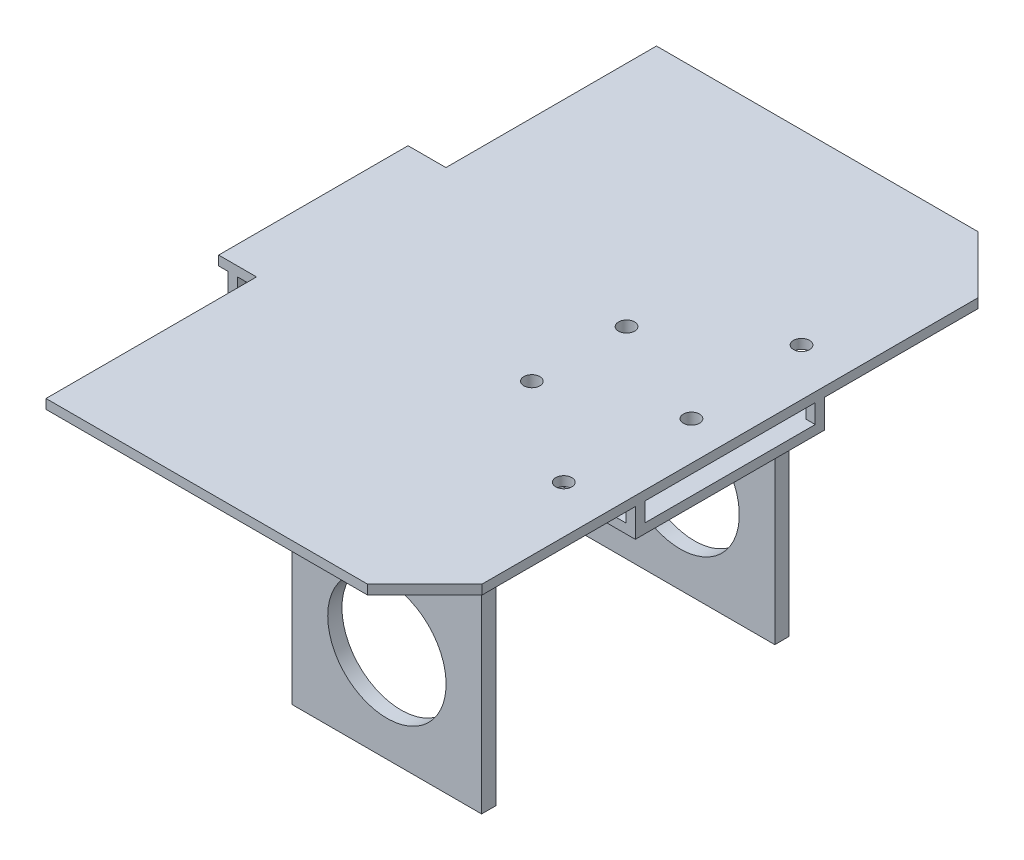
from build123d import *

# Parameters (mm, degrees)
SKETCH1_W                = 40
SKETCH1_H                = 40
BOSS_EXTRUDE1_DEPTH      = 2
SKETCH10_W               = 40
SKETCH10_H               = 2
BOSS_EXTRUDE4_DEPTH      = 4
SKETCH11_W               = 40
SKETCH11_H               = 40
BOSS_EXTRUDE5_DEPTH      = 2
M3_CLEARANCE_HOLE1_D     = 3.4
SKETCH5_W                = 40
SKETCH5_H                = 2
BOSS_EXTRUDE2_DEPTH      = 48
SKETCH6_W                = 2
SKETCH6_H                = 40
BOSS_EXTRUDE3_DEPTH      = 6
SKETCH7_W                = 2
SKETCH7_H                = 28
CUT_EXTRUDE1_DEPTH       = 6
M3_CLEARANCE_HOLE2_D     = 3.4
M3_CLEARANCE_HOLE2_DEPTH = 2
M3_CLEARANCE_HOLE2_TIP   = 1.021463052
SKETCH12_W               = 36
SKETCH12_H               = 4
CUT_EXTRUDE2_DEPTH       = 63.992062992
EXTRUDE_THIN1_REACH      = 64.769
SKETCH13_R               = 3.7
SKETCH13_R_2             = 1.7
SKETCH14_W               = 40
SKETCH14_H               = 2
BOSS_EXTRUDE6_DEPTH      = 44.465
M3_CLEARANCE_HOLE3_D     = 3.4
SKETCH19_W               = 40
SKETCH19_H               = 2
BOSS_EXTRUDE7_DEPTH      = 44.465
SKETCH20_R               = 1.7
CUT_EXTRUDE3_DEPTH       = 98.479927293
CUT_EXTRUDE4_DEPTH       = 98.479927293
SKETCH24_W               = 44.465
SKETCH24_H               = 2
BOSS_EXTRUDE9_DEPTH      = 40
SKETCH22_W               = 40
SKETCH22_H               = 3
BOSS_EXTRUDE8_DEPTH      = 60
FILLET1_R                = 2
CUT_EXTRUDE5_REACH       = 122.894
SKETCH23_R               = 12.5
FILLET1_OF_MIRROR1_R     = 2


with BuildPart() as part:
    # Sketch1 → Boss-Extrude1 (new body)
    with BuildSketch(Plane(origin=(0, 0, 0), x_dir=(1, 0, 0), z_dir=(0, 1, 0))):
        with Locations((20, 20)):
            Rectangle(SKETCH1_W, SKETCH1_H)
    extrude(amount=BOSS_EXTRUDE1_DEPTH)

    # Sketch10 → Boss-Extrude4 (add)
    with BuildSketch(Plane(origin=(0, 2, 0), x_dir=(1, 0, 0), z_dir=(0, 1, 0))):
        with Locations((20, 1)):
            Rectangle(SKETCH10_W, SKETCH10_H)
        with Locations((20, 39)):
            Rectangle(SKETCH10_W, SKETCH10_H)
    extrude(amount=BOSS_EXTRUDE4_DEPTH)

    # Sketch11 → Boss-Extrude5 (add)
    with BuildSketch(Plane(origin=(0, 6, 0), x_dir=(1, 0, 0), z_dir=(0, 1, 0))):
        with Locations((20, 20)):
            Rectangle(SKETCH11_W, SKETCH11_H)
    extrude(amount=BOSS_EXTRUDE5_DEPTH)

    # M3 Clearance Hole1 (through all)
    with Locations(Plane.XZ):
        with Locations((8.15, -30), (8.15, -10), (31.85, -20)):
            Hole(M3_CLEARANCE_HOLE1_D / 2)

    # Sketch5 → Boss-Extrude2 (add)
    with BuildSketch(Plane(origin=(0, 0, 0), x_dir=(0, 0, -1), z_dir=(1, 0, 0))):
        with Locations((20, 7)):
            Rectangle(SKETCH5_W, SKETCH5_H)
    extrude(amount=-BOSS_EXTRUDE2_DEPTH)

    # Sketch6 → Boss-Extrude3 (add)
    with BuildSketch(Plane(origin=(-6, 6, 0), x_dir=(-1, 0, 0), z_dir=(0, 1, 0))):
        with Locations((39, -20)):
            Rectangle(SKETCH6_W, SKETCH6_H)
    extrude(amount=-BOSS_EXTRUDE3_DEPTH)

    # Sketch7 → Cut-Extrude1 (cut)
    with BuildSketch(Plane(origin=(46, 0, 0), x_dir=(-1, 0, 0), z_dir=(0, 1, 0))):
        with Locations((91, -20)):
            Rectangle(SKETCH7_W, SKETCH7_H)
    extrude(amount=CUT_EXTRUDE1_DEPTH, mode=Mode.SUBTRACT)

    # M3 Clearance Hole2
    with Locations(Plane(origin=(-46, 0, 0), x_dir=(0, 0, -1), z_dir=(-1, 0, 0))):
        with Locations((3, -3), (37, -3)):
            Hole(M3_CLEARANCE_HOLE2_D / 2, depth=M3_CLEARANCE_HOLE2_DEPTH)
            with Locations((0, 0, -(M3_CLEARANCE_HOLE2_DEPTH + M3_CLEARANCE_HOLE2_TIP / 2))):  # 118° drill point
                Cone(0, M3_CLEARANCE_HOLE2_D / 2, M3_CLEARANCE_HOLE2_TIP, mode=Mode.SUBTRACT)

    # Sketch12 → Cut-Extrude2 (cut, through all)
    with BuildSketch(Plane(origin=(0, 0, -40), x_dir=(-1, 0, 0), z_dir=(0, 0, -1))):
        with Locations((-20, 4)):
            Rectangle(SKETCH12_W, SKETCH12_H)
    extrude(amount=-CUT_EXTRUDE2_DEPTH, mode=Mode.SUBTRACT)

    # Sketch13 → Extrude-Thin1 (add, up to next)
    with BuildSketch(Plane(origin=(0, 2, 0), x_dir=(1, 0, 0), z_dir=(0, 1, 0)), mode=Mode.PRIVATE) as extrude_thin1_sk1:
        with Locations((31.85, 20)):
            Circle(SKETCH13_R)
        with Locations((31.85, 20)):
            Circle(SKETCH13_R_2, mode=Mode.SUBTRACT)
    extrude_thin1_tool1 = extrude(extrude_thin1_sk1.sketch, amount=EXTRUDE_THIN1_REACH, mode=Mode.PRIVATE) - part.part
    # Sketch13 → Extrude-Thin1 (add, up to next)
    with BuildSketch(Plane(origin=(0, 2, 0), x_dir=(1, 0, 0), z_dir=(0, 1, 0)), mode=Mode.PRIVATE) as extrude_thin1_sk2:
        with Locations((8.15, 10)):
            Circle(SKETCH13_R)
        with Locations((8.15, 10)):
            Circle(SKETCH13_R_2, mode=Mode.SUBTRACT)
    extrude_thin1_tool2 = extrude(extrude_thin1_sk2.sketch, amount=EXTRUDE_THIN1_REACH, mode=Mode.PRIVATE) - part.part
    # Sketch13 → Extrude-Thin1 (add, up to next)
    with BuildSketch(Plane(origin=(0, 2, 0), x_dir=(1, 0, 0), z_dir=(0, 1, 0)), mode=Mode.PRIVATE) as extrude_thin1_sk3:
        with Locations((8.15, 30)):
            Circle(SKETCH13_R)
        with Locations((8.15, 30)):
            Circle(SKETCH13_R_2, mode=Mode.SUBTRACT)
    extrude_thin1_tool3 = extrude(extrude_thin1_sk3.sketch, amount=EXTRUDE_THIN1_REACH, mode=Mode.PRIVATE) - part.part
    add(extrude_thin1_tool1.solids().sort_by_distance((28.254652, 2, -20))[0])
    add(extrude_thin1_tool2.solids().sort_by_distance((4.554652, 2, -10))[0])
    add(extrude_thin1_tool3.solids().sort_by_distance((4.554652, 2, -30))[0])

    # Sketch14 → Boss-Extrude6 (add)
    with BuildSketch(Plane(origin=(0, 0, -40), x_dir=(-1, 0, 0), z_dir=(0, 0, -1))):
        with Locations((-20, 7)):
            Rectangle(SKETCH14_W, SKETCH14_H)
    extrude(amount=BOSS_EXTRUDE6_DEPTH)

    # M3 Clearance Hole3 (through all)
    with Locations(Plane(origin=(0, 8, 0), x_dir=(1, 0, 0), z_dir=(0, 1, 0))):
        with Locations((30, 45.10564971)):
            Hole(M3_CLEARANCE_HOLE3_D / 2)

    # Sketch19 → Boss-Extrude7 (add)
    with BuildSketch(Plane.XY):
        with Locations((20, 7)):
            Rectangle(SKETCH19_W, SKETCH19_H)
    extrude(amount=BOSS_EXTRUDE7_DEPTH)

    # Sketch20 → Cut-Extrude3 (cut, through all)
    with BuildSketch(Plane(origin=(0, 8, 0), x_dir=(1, 0, 0), z_dir=(0, 1, 0))):
        with Locations(Location((30, -5.10564971, 0), (0, 0, 270))):
            Circle(SKETCH20_R)
    extrude(amount=-CUT_EXTRUDE3_DEPTH, mode=Mode.SUBTRACT)

    # Sketch21 → Cut-Extrude4 (cut, through all)
    with BuildSketch(Plane(origin=(0, 8, 0), x_dir=(1, 0, 0), z_dir=(0, 1, 0))):
        Polygon((27.91, -44.465), (40, -32.375), (40, -44.465), align=None)
        Polygon((27.91, 84.465), (40, 84.465), (40, 72.375), align=None)
    extrude(amount=-CUT_EXTRUDE4_DEPTH, mode=Mode.SUBTRACT)

    # Sketch24 → Boss-Extrude9 (add)
    with BuildSketch(Plane.ZY):
        with Locations((-62.2325, 7)):
            Rectangle(SKETCH24_W, SKETCH24_H)
    boss_extrude9 = extrude(amount=BOSS_EXTRUDE9_DEPTH)

    # Sketch22 → Boss-Extrude8 (add)
    with BuildSketch(Plane.XZ.offset(-6)):
        with Locations((0, -50.965)):
            Rectangle(SKETCH22_W, SKETCH22_H)
    boss_extrude8 = extrude(amount=BOSS_EXTRUDE8_DEPTH)

    # Fillet1
    fillet1_edges = [part.edges().sort_by_distance(p)[0] for p in [
        (20, 6, -50.965),
        (0, 6, -49.465),
        (-20, 6, -50.965),
        (0, 6, -52.465),
    ]]
    fillet(fillet1_edges, radius=FILLET1_R)

    # Sketch23 → Cut-Extrude5 (cut, up to next)
    with BuildSketch(Plane(origin=(0, 0, -52.465), x_dir=(-1, 0, 0), z_dir=(0, 0, -1)), mode=Mode.PRIVATE) as cut_extrude5_sk1:
        with Locations((0, -34)):
            Circle(SKETCH23_R)
    cut_extrude5_tool1 = extrude(cut_extrude5_sk1.sketch, amount=-CUT_EXTRUDE5_REACH, mode=Mode.PRIVATE) & part.part
    cut_extrude5 = cut_extrude5_tool1.solids().sort_by_distance((0, -34, -52.465))[0]
    add(cut_extrude5, mode=Mode.SUBTRACT)

    # Mirror1: Boss-Extrude9, Boss-Extrude8, Cut-Extrude5 across plane
    add(boss_extrude9.mirror(Plane(origin=(0, 0, -20), x_dir=(1, 0, 0), z_dir=(0, 0, -1))))
    add(boss_extrude8.mirror(Plane(origin=(0, 0, -20), x_dir=(1, 0, 0), z_dir=(0, 0, -1))))
    add(cut_extrude5.mirror(Plane(origin=(0, 0, -20), x_dir=(1, 0, 0), z_dir=(0, 0, -1))), mode=Mode.SUBTRACT)

    # Fillet1 of Mirror1
    fillet1_of_mirror1_edges = [part.edges().sort_by_distance(p)[0] for p in [
        (20, 6, 10.965),
        (0, 6, 9.465),
        (-20, 6, 10.965),
        (0, 6, 12.465),
    ]]
    fillet(fillet1_of_mirror1_edges, radius=FILLET1_OF_MIRROR1_R)


solid = part.part
